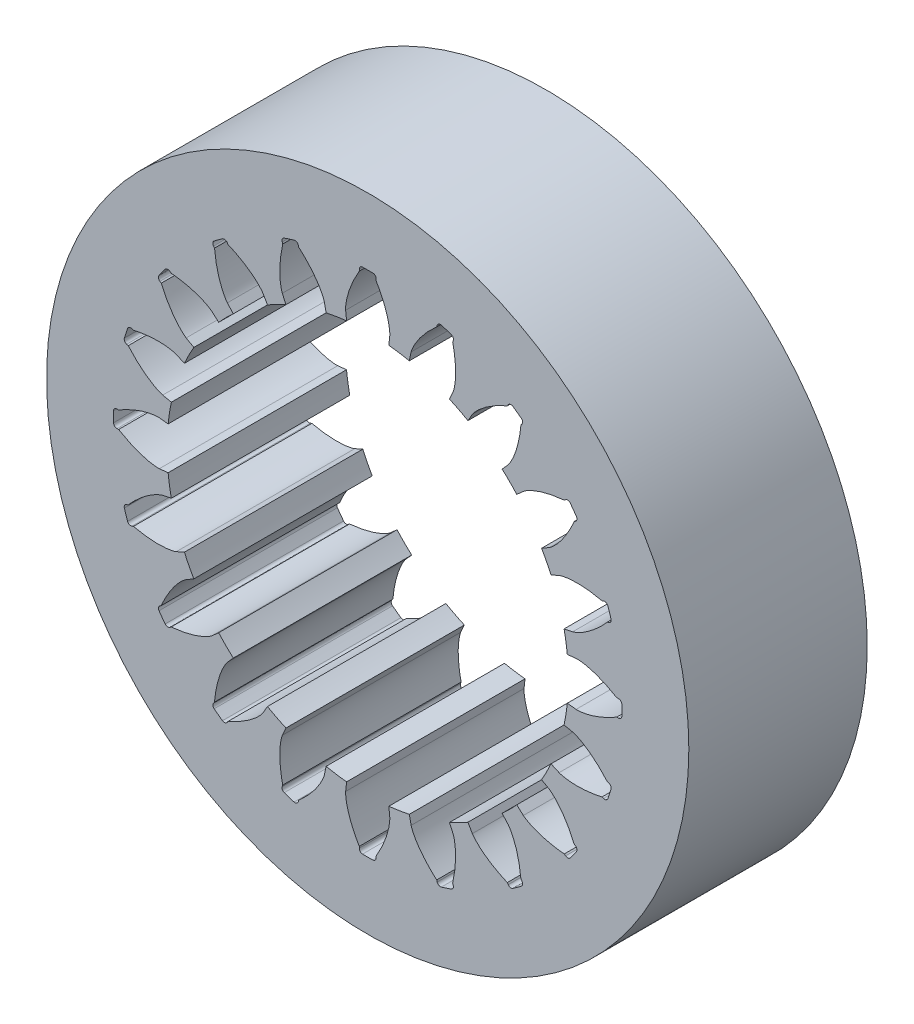
from build123d import *

# Parameters (mm, degrees)
BLANK_SKETCH_R    = 18
BLANK_SKETCH_R_2  = 11.25
BLANK_DEPTH       = 10
TOOTH_SPACE_DEPTH = 28.349588662
TEETH_COUNT       = 20


with BuildPart() as part:
    # Blank Sketch → Blank (new body)
    with BuildSketch(Plane.XY):
        Circle(BLANK_SKETCH_R)
        Circle(BLANK_SKETCH_R_2, mode=Mode.SUBTRACT)
    extrude(amount=BLANK_DEPTH)

    # Tooth Space Sketch → Tooth Space (cut, symmetric)
    with BuildSketch(Plane.XY):
        with BuildLine():
            Line((11.680918534, 1.236270328), (9.944459093, 1.052489123))
            Line((9.944459093, 1.052489123), (9.944459093, -1.052489123))
            Line((9.944459093, -1.052489123), (11.680918534, -1.236270328))
            add(Edge.make_bspline(
                [(11.680918534, -1.236270328), (11.684500968, -1.236600224), (11.694562724, -1.237374429), (11.713637062, -1.238241238), (11.744818029, -1.2388066), (11.784616724, -1.238278395), (11.836110554, -1.236161049), (11.896814833, -1.231821602), (11.963541427, -1.225119819), (12.03611956, -1.215744005), (12.108485656, -1.204548111), (12.180611872, -1.191667023), (12.252388777, -1.177291787), (12.339222172, -1.158057732), (12.443172036, -1.132464171), (12.564354313, -1.098873738), (12.701364105, -1.056446852), (12.840446449, -1.008596706), (12.976817184, -0.957729554), (13.113950886, -0.902010419), (13.246167608, -0.845035759), (13.382724253, -0.78145955), (13.50838591, -0.720535577), (13.648211211, -0.647447829), (13.760779343, -0.587051265), (13.876192741, -0.520659245), (13.93223371, -0.487756613), (13.960817457, -0.470693641)],
                knots=[0, 0, 0, 0, 0, 0.005376749, 0.015083688, 0.02853182, 0.04661014, 0.064854849, 0.092110526, 0.119476176, 0.146842496, 0.174208854, 0.201574956, 0.228941013, 0.256307345, 0.307035032, 0.361767352, 0.416499661, 0.471231937, 0.525964282, 0.580696616, 0.635428982, 0.690161387, 0.744893688, 0.799626082, 0.854358408, 0.909090915, 0.909090915, 0.909090915, 0.909090915, 0.909090915], degree=4))
            Line((13.960817457, -0.470693641), (14.053264872, -0.473810536))
            ThreePointArc((14.053264872, -0.473810536), (14.188532953, -0.422535109), (14.247044013, -0.290235907))
            ThreePointArc((14.247044013, -0.290235907), (14.25, 0), (14.247044013, 0.290235907))
            ThreePointArc((14.247044013, 0.290235907), (14.188532953, 0.422535109), (14.053264872, 0.473810536))
            Line((14.053264872, 0.473810536), (13.960817457, 0.470693641))
            add(Edge.make_bspline(
                [(11.680918534, 1.236270328), (11.684500968, 1.236600224), (11.694562724, 1.237374429), (11.713637062, 1.238241238), (11.744818029, 1.2388066), (11.784616724, 1.238278395), (11.836110554, 1.236161049), (11.896814833, 1.231821602), (11.963541427, 1.225119819), (12.03611956, 1.215744005), (12.108485656, 1.204548111), (12.180611872, 1.191667023), (12.252388777, 1.177291787), (12.339222172, 1.158057732), (12.443172036, 1.132464171), (12.564354313, 1.098873738), (12.701364105, 1.056446852), (12.840446449, 1.008596706), (12.976817184, 0.957729554), (13.113950886, 0.902010419), (13.246167608, 0.845035759), (13.382724253, 0.78145955), (13.50838591, 0.720535577), (13.648211211, 0.647447829), (13.760779343, 0.587051265), (13.876192741, 0.520659245), (13.93223371, 0.487756613), (13.960817457, 0.470693641)],
                knots=[0, 0, 0, 0, 0, 0.005376749, 0.015083688, 0.02853182, 0.04661014, 0.064854849, 0.092110526, 0.119476176, 0.146842496, 0.174208854, 0.201574956, 0.228941013, 0.256307345, 0.307035032, 0.361767352, 0.416499661, 0.471231937, 0.525964282, 0.580696616, 0.635428982, 0.690161387, 0.744893688, 0.799626082, 0.854358408, 0.909090915, 0.909090915, 0.909090915, 0.909090915, 0.909090915], degree=4))
        make_face()
    tooth_space = extrude(amount=TOOTH_SPACE_DEPTH, both=True, mode=Mode.SUBTRACT)

    # Teeth: Tooth Space ×20 about axis
    teeth_axis = Axis((0, 0, -0.50007105), (0, 0, 1))
    for i in range(1, TEETH_COUNT):
        add(tooth_space.rotate(teeth_axis, i * 360 / TEETH_COUNT), mode=Mode.SUBTRACT)


solid = part.part
